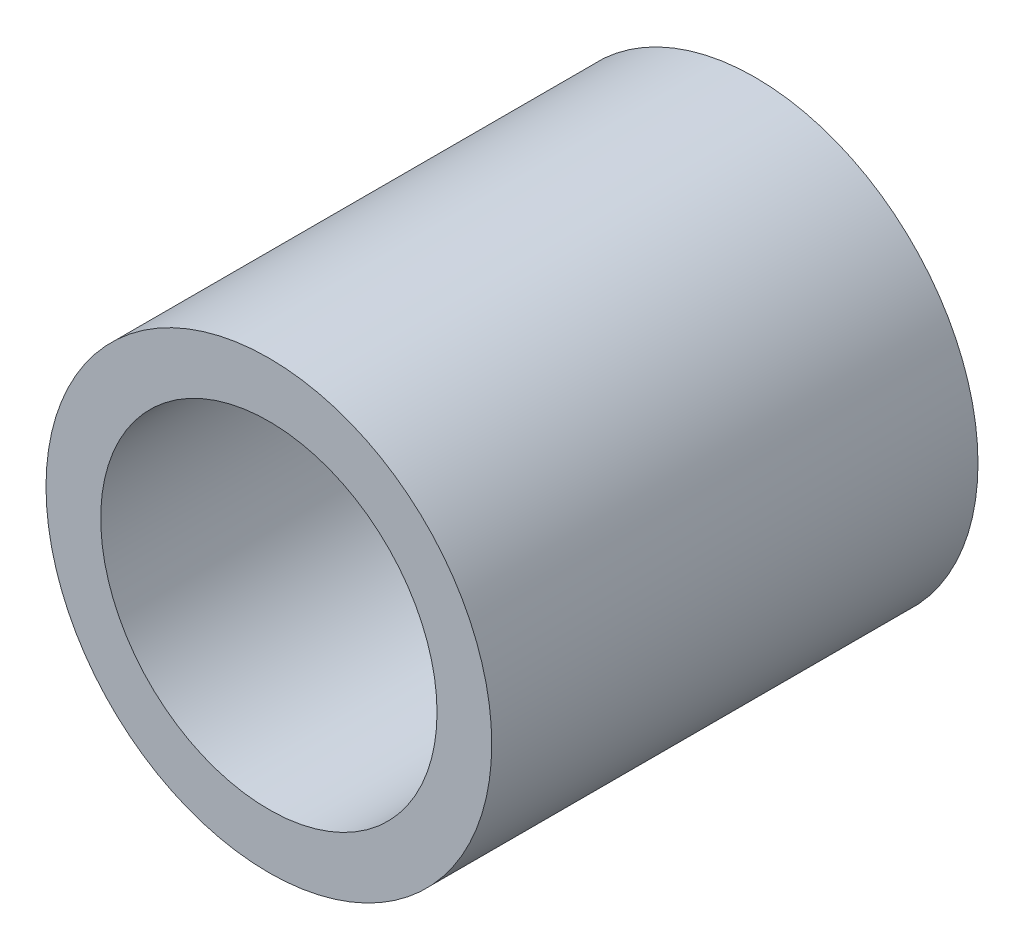
from build123d import *

# Parameters (mm, degrees)
SKETCH1_R           = 5.5
SKETCH1_R_2         = 4.15
BOSS_EXTRUDE1_DEPTH = 12


with BuildPart() as part:
    # Sketch1 → Boss-Extrude1 (new body)
    with BuildSketch(Plane.XY):
        Circle(SKETCH1_R)
        Circle(SKETCH1_R_2, mode=Mode.SUBTRACT)
    extrude(amount=BOSS_EXTRUDE1_DEPTH)


solid = part.part
